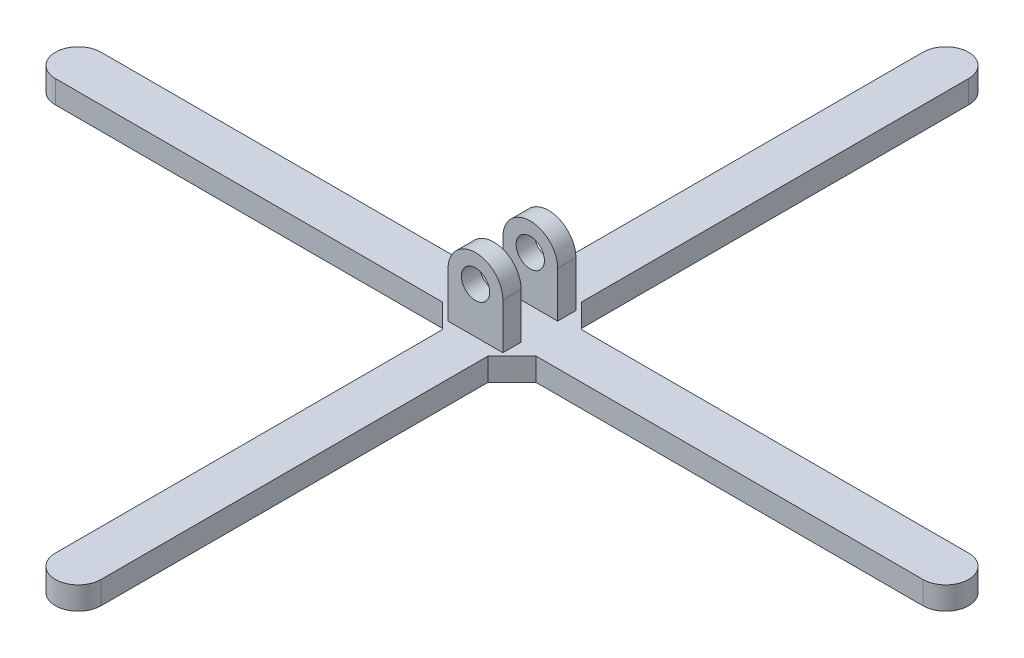
from build123d import *

# Parameters (mm, degrees)
BOSS_EXTRUDE1_DEPTH = 2.5
SKETCH2_R           = 1.55
BOSS_EXTRUDE2_DEPTH = 1


with BuildPart() as part:
    # Sketch1 → Boss-Extrude1 (new body)
    with BuildSketch(Plane(origin=(0, 0, 0), x_dir=(1, 0, 0), z_dir=(0, 1, 0))):
        with BuildLine():
            Line((2.5, 47.5), (2.5, 5.126263096))
            Line((2.5, 5.126263096), (5.126263096, 2.5))
            Line((5.126263096, 2.5), (47.5, 2.5))
            ThreePointArc((47.5, 2.5), (50, 0), (47.5, -2.5))
            Line((47.5, -2.5), (5.126263096, -2.5))
            Line((5.126263096, -2.5), (2.5, -5.126263096))
            Line((2.5, -5.126263096), (2.5, -47.5))
            ThreePointArc((2.5, -47.5), (0, -50), (-2.5, -47.5))
            Line((-2.5, -47.5), (-2.5, -5.126263096))
            Line((-2.5, -5.126263096), (-5.126263096, -2.5))
            Line((-5.126263096, -2.5), (-47.5, -2.5))
            ThreePointArc((-47.5, -2.5), (-50, 0), (-47.5, 2.5))
            Line((-47.5, 2.5), (-5.126263096, 2.5))
            Line((-5.126263096, 2.5), (-2.5, 5.126263096))
            Line((-2.5, 5.126263096), (-2.5, 47.5))
            ThreePointArc((-2.5, 47.5), (0, 50), (2.5, 47.5))
        make_face()
    extrude(amount=BOSS_EXTRUDE1_DEPTH)

    # Sketch2 → Boss-Extrude2 (add, symmetric)
    with BuildSketch(Plane.XY.offset(3)):
        with BuildLine():
            Line((-3, 2.5), (3, 2.5))
            Line((3, 2.5), (3, 7.5))
            ThreePointArc((3, 7.5), (0, 10.5), (-3, 7.5))
            Line((-3, 7.5), (-3, 2.5))
        make_face()
        with Locations((0, 7.5)):
            Circle(SKETCH2_R, mode=Mode.SUBTRACT)
    boss_extrude2 = extrude(amount=BOSS_EXTRUDE2_DEPTH, both=True)

    # Mirror2: Boss-Extrude2 across plane
    add(boss_extrude2.mirror(Plane.XY))


solid = part.part
